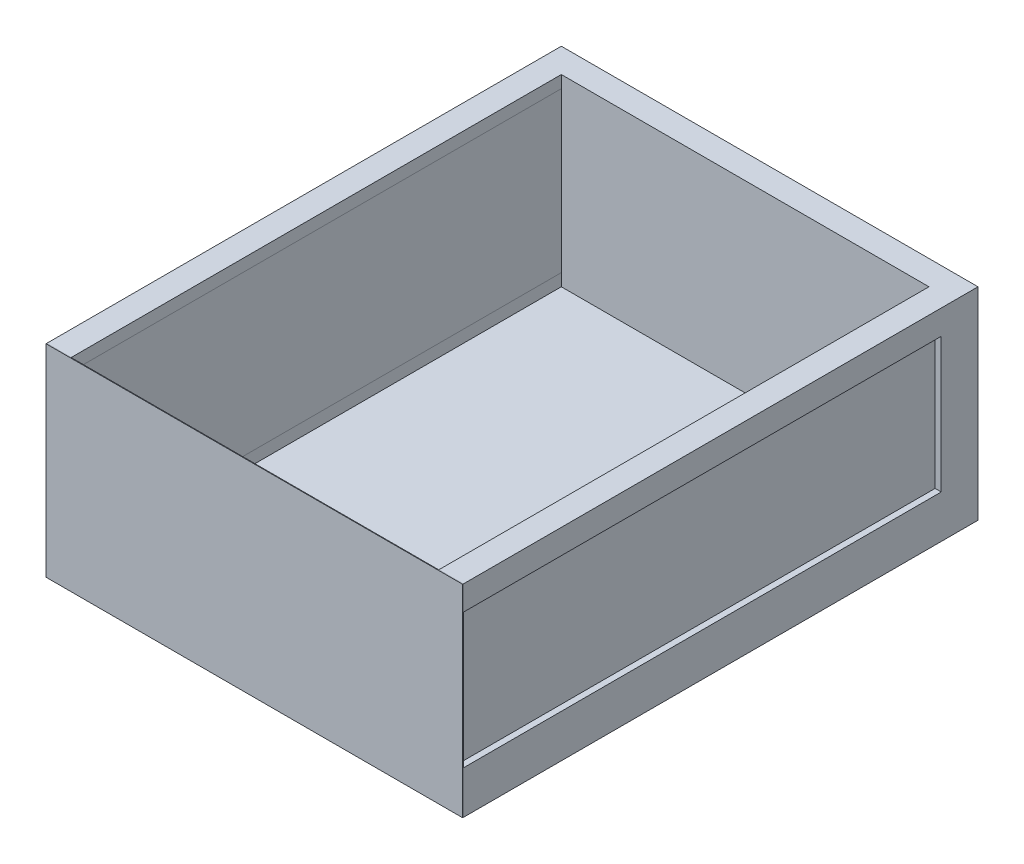
from build123d import *

# Parameters (mm, degrees)
SKETCH1_W           = 68
SKETCH1_H           = 84
BOSS_EXTRUDE1_DEPTH = 3
BOSS_EXTRUDE2_DEPTH = 30
SKETCH3_W           = 78
SKETCH3_H           = 22
CUT_EXTRUDE1_DEPTH  = 1
SKETCH4_W           = 80
SKETCH4_H           = 26
CUT_EXTRUDE2_DEPTH  = 3
SKETCH5_W           = 80
SKETCH5_H           = 26
CUT_EXTRUDE3_DEPTH  = 3
SKETCH7_W           = 78
SKETCH7_H           = 22
CUT_EXTRUDE4_DEPTH  = 1
SKETCH8_W           = 80
SKETCH8_H           = 26
BOSS_EXTRUDE4_DEPTH = 3
SKETCH9_W           = 80
SKETCH9_H           = 26
BOSS_EXTRUDE5_DEPTH = 3
SKETCH10_W          = 68
SKETCH10_H          = 33
BOSS_EXTRUDE6_DEPTH = 0.1


with BuildPart() as part:
    # Sketch1 → Boss-Extrude1 (new body)
    with BuildSketch(Plane(origin=(0, 0, 0), x_dir=(1, 0, 0), z_dir=(0, 1, 0))):
        Rectangle(SKETCH1_W, SKETCH1_H)
    extrude(amount=BOSS_EXTRUDE1_DEPTH)

    # Sketch2 → Boss-Extrude2 (add)
    with BuildSketch(Plane(origin=(0, 3, 0), x_dir=(1, 0, 0), z_dir=(0, 1, 0))):
        Polygon((-30, -42), (-34, -42), (-34, 42), (34, 42), (34, -42), (30, -42), (30, 38), (-30, 38), align=None)
    extrude(amount=BOSS_EXTRUDE2_DEPTH)

    # Sketch3 → Cut-Extrude1 (cut)
    with BuildSketch(Plane.ZY.offset(34)):
        with Locations((3, 18)):
            Rectangle(SKETCH3_W, SKETCH3_H)
    extrude(amount=-CUT_EXTRUDE1_DEPTH, mode=Mode.SUBTRACT)

    # Sketch4 → Cut-Extrude2 (cut)
    with BuildSketch(Plane(origin=(-30, 0, 0), x_dir=(0, 0, -1), z_dir=(1, 0, 0))):
        with Locations((-2, 18)):
            Rectangle(SKETCH4_W, SKETCH4_H)
    extrude(amount=-CUT_EXTRUDE2_DEPTH, mode=Mode.SUBTRACT)

    # Sketch5 → Cut-Extrude3 (cut)
    with BuildSketch(Plane.ZY.offset(-30)):
        with Locations((2, 18)):
            Rectangle(SKETCH5_W, SKETCH5_H)
    extrude(amount=-CUT_EXTRUDE3_DEPTH, mode=Mode.SUBTRACT)

    # Sketch7 → Cut-Extrude4 (cut)
    with BuildSketch(Plane(origin=(34, 0, 0), x_dir=(0, 0, -1), z_dir=(1, 0, 0))):
        with Locations((-3, 18)):
            Rectangle(SKETCH7_W, SKETCH7_H)
    extrude(amount=-CUT_EXTRUDE4_DEPTH, mode=Mode.SUBTRACT)


with BuildPart() as body_2:
    # Sketch8 → Boss-Extrude4 (new body)
    with BuildSketch(Plane(origin=(-30, 0, 0), x_dir=(0, 0, -1), z_dir=(1, 0, 0))):
        with Locations((-2, 18)):
            Rectangle(SKETCH8_W, SKETCH8_H)
    extrude(amount=-BOSS_EXTRUDE4_DEPTH)


with BuildPart() as body_3:
    # Sketch9 → Boss-Extrude5 (new body)
    with BuildSketch(Plane.ZY.offset(-30)):
        with Locations((2, 18)):
            Rectangle(SKETCH9_W, SKETCH9_H)
    extrude(amount=-BOSS_EXTRUDE5_DEPTH)


with BuildPart() as body_4:
    # Sketch10 → Boss-Extrude6 (new body)
    with BuildSketch(Plane.XY.offset(42)):
        with Locations((0, 16.5)):
            Rectangle(SKETCH10_W, SKETCH10_H)
    extrude(amount=BOSS_EXTRUDE6_DEPTH)


solid = Compound([part.part, body_2.part, body_3.part, body_4.part])
